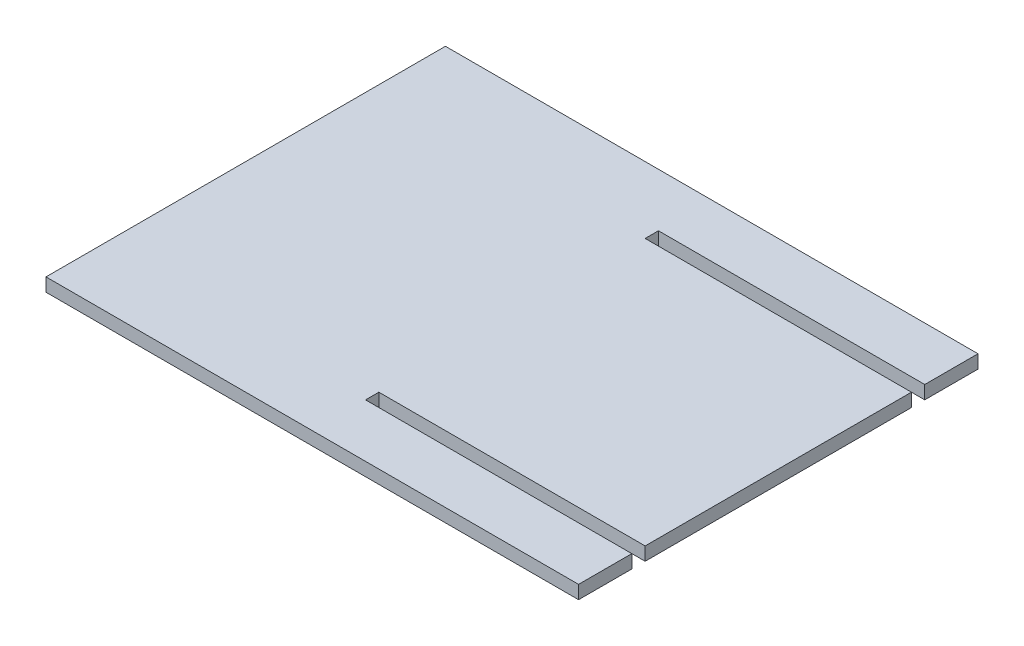
from build123d import *

# Parameters (mm, degrees)
BOSS_EXTRUDE2_DEPTH = 3


with BuildPart() as part:
    # Sketch1 → Boss-Extrude2 (new body)
    with BuildSketch(Plane(origin=(0, 0, 0), x_dir=(1, 0, 0), z_dir=(0, 1, 0))):
        Polygon((60, -30), (60, 30), (0, 30), (0, 33), (60, 33), (60, 45), (-60, 45), (-60, -45), (60, -45), (60, -33), (0, -33), (0, -30), align=None)
    extrude(amount=BOSS_EXTRUDE2_DEPTH)


solid = part.part
